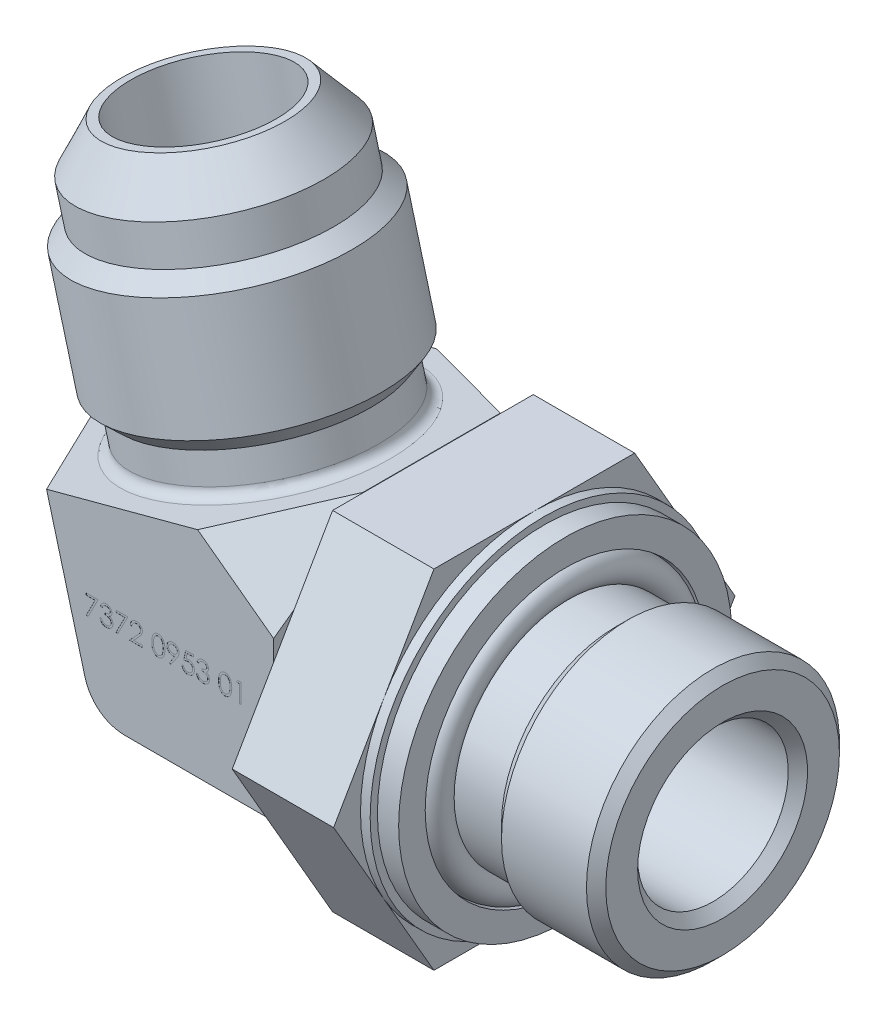
from build123d import *
from OCP.BRepFilletAPI import BRepFilletAPI_MakeChamfer

# Parameters (mm, degrees)
EXTRUDE1_DEPTH      = 15
CHAMFER1_SIZE       = 12
CHAMFER1_SIZE2      = 6.92820323
FILLET1_R           = 11
CHAMFER2_SIZE       = 10
CHAMFER2_SIZE2      = 5.773502692
FILLET4_R           = 5
FILLET3_R           = 1
BOSS_EXTRUDE1_START = 1.5
SKETCH8_R           = 7.8
BOSS_EXTRUDE1_DEPTH = 10.5
SKETCH10_R          = 1.5
CUT_EXTRUDE1_DEPTH  = 0.01


with BuildPart() as part:
    # Sketch1 → Extrude1 (new, symmetric)
    with BuildSketch(Plane.XY):
        Polygon((-0.372025703, 0.275284539), (0.372025703, -0.275284539), (0.372025703, -30.775284539), (-23.627974297, -30.775284539), (-29.832763405, -7.618696336), align=None)
    extrude(amount=EXTRUDE1_DEPTH, both=True)

    # Chamfer1: one chamfer whose edges measure the first distance from different faces: ONE call of the kernel's chamfer builder (chamfer() names one face for all edges)
    chamfer1_edges_1 = [part.edges().sort_by_distance(p)[0] for p in [
        (-11.627974297, -30.775284539, 15),
        (-11.627974297, -30.775284539, -15),
    ]]
    chamfer1_side_1 = [part.faces().sort_by_distance(p)[0] for p in [
        (-11.627974297, -30.775284539, 0),
    ]]
    chamfer1_edges_2 = [part.edges().sort_by_distance(p)[0] for p in [
        (-26.730368851, -19.196990438, -15),
        (-26.730368851, -19.196990438, 15),
    ]]
    chamfer1_side_2 = [part.faces().sort_by_distance(p)[0] for p in [
        (-26.730368851, -19.196990438, 0),
    ]]
    chamfer1 = BRepFilletAPI_MakeChamfer(part.part.solid().wrapped)
    for e in chamfer1_edges_1:
        chamfer1.Add(CHAMFER1_SIZE, CHAMFER1_SIZE2, e.wrapped, chamfer1_side_1[0].wrapped)  # the first distance lies on this face
    for e in chamfer1_edges_2:
        chamfer1.Add(CHAMFER1_SIZE, CHAMFER1_SIZE2, e.wrapped, chamfer1_side_2[0].wrapped)  # the first distance lies on this face
    add(Compound.cast(chamfer1.Shape()), mode=Mode.REPLACE)

    # Fillet1
    fillet1_edges = [part.edges().sort_by_distance(p)[0] for p in [
        (-23.627974297, -30.775284539, 0),
    ]]
    fillet(fillet1_edges, radius=FILLET1_R)

    # Chamfer2: one chamfer whose edges measure the first distance from different faces: ONE call of the kernel's chamfer builder (chamfer() names one face for all edges)
    chamfer2_edges_1 = [part.edges().sort_by_distance(p)[0] for p in [
        (0, 0, 15),
    ]]
    chamfer2_side_1 = [part.faces().sort_by_distance(p)[0] for p in [
        (0, 0, 0),
    ]]
    chamfer2_edges_2 = [part.edges().sort_by_distance(p)[0] for p in [
        (0, 0, -15),
    ]]
    chamfer2_side_2 = [part.faces().sort_by_distance(p)[0] for p in [
        (-9.779622009, -12.745049455, -15),
    ]]
    chamfer2 = BRepFilletAPI_MakeChamfer(part.part.solid().wrapped)
    for e in chamfer2_edges_1:
        chamfer2.Add(CHAMFER2_SIZE, CHAMFER2_SIZE2, e.wrapped, chamfer2_side_1[0].wrapped)  # the first distance lies on this face
    for e in chamfer2_edges_2:
        chamfer2.Add(CHAMFER2_SIZE, CHAMFER2_SIZE2, e.wrapped, chamfer2_side_2[0].wrapped)  # the first distance lies on this face
    add(Compound.cast(chamfer2.Shape()), mode=Mode.REPLACE)

    # Fillet4
    fillet4_edges = [part.edges().sort_by_distance(p)[0] for p in [
        (-20.097765064, -26.174626296, 10.968573826),
        (-20.097765064, -26.174626296, -10.968573826),
    ]]
    fillet(fillet4_edges, radius=FILLET4_R)

    # Sketch4 → Revolve1 (revolve)
    with BuildSketch(Plane.XY, mode=Mode.PRIVATE) as revolve1_sk:
        Polygon((-29.343104541, -1.741709838), (-32.371287369, 9.55962233), (-31.275271858, 11.457976881), (-32.281084351, 15.211720207), (-30.351454157, 19.987722531), (-29.433824622, 20.233600623), (-22.497474213, -5.653211521), (-26.40947381, -6.701428654), (-27.44474999, -2.837725349), align=None)
    revolve(revolve1_sk.sketch.rotate(Axis((-14.963252768, -3.634422969, 0), (-0.25881904510251813, 0.965925826289069, 0)), 180), axis=Axis((-14.963252768, -3.634422969, 0), (-0.25881904510251813, 0.965925826289069, 0)))

    # Sketch5 → Revolve2 (revolve)
    with BuildSketch(Plane.XY, mode=Mode.PRIVATE) as revolve2_sk:
        Polygon((0.372025703, -2.425284539), (14.072025703, -2.425284539), (15.372025703, -3.725284539), (20.772025703, -3.725284539), (22.072025703, -2.425284539), (30.872025703, -2.425284539), (31.872025703, -3.425284539), (31.872025703, -6.725284539), (30.872025703, -7.725284539), (0.372025703, -7.725284539), align=None)
    revolve(revolve2_sk.sketch.rotate(Axis((0.372025703, -15.525284539, 0), (1, 0, 0)), 90), axis=Axis((0.372025703, -15.525284539, 0), (1, 0, 0)))

    # Fillet3
    fillet3_edges = [part.edges().sort_by_distance(p)[0] for p in [
        (-26.40947381, -6.701428654, 0),
        (0.372025703, -15.525284539, -13.1),
    ]]
    fillet(fillet3_edges, radius=FILLET3_R)

    # Sketch6 → Cut-Revolve1 (revolve, cut)
    with BuildSketch(Plane.XY, mode=Mode.PRIVATE) as cut_revolve1_sk:
        Polygon((31.872025703, -7.725284539), (-13.441261468, -7.725284539), (-18.127974297, -15.525284539), (31.872025703, -15.525284539), align=None)
    revolve(cut_revolve1_sk.sketch.rotate(Axis((31.872025703, -15.525284539, 0), (-1, 0, 0)), 270), axis=Axis((31.872025703, -15.525284539, 0), (-1, 0, 0)), mode=Mode.SUBTRACT)

    # Sketch7 → Cut-Revolve2 (revolve, cut)
    with BuildSketch(Plane.XY, mode=Mode.PRIVATE) as cut_revolve2_sk:
        Polygon((-29.433824622, 20.233600623), (-19.776435267, -15.808267119), (-11.029203283, -18.316495529), (-21.899603177, 22.252389175), align=None)
    revolve(cut_revolve2_sk.sketch.rotate(Axis((-20.77322406, 18.048685082, 0), (0.2588190451025186, -0.965925826289069, 0)), 180), axis=Axis((-20.77322406, 18.048685082, 0), (0.2588190451025186, -0.965925826289069, 0)), mode=Mode.SUBTRACT)

    # Sketch8 → Boss-Extrude1 (add)
    with BuildSketch(Plane(origin=(0.372025703, 0, 0), x_dir=(0, 0, -1), z_dir=(1, 0, 0)).offset(BOSS_EXTRUDE1_START)):
        Polygon((20.784609691, -15.525284539), (10.392304845, 2.474715461), (-10.392304845, 2.474715461), (-20.784609691, -15.525284539), (-10.392304845, -33.525284539), (10.392304845, -33.525284539), align=None)
        with Locations(Location((0, -15.525284539, 0), (0, 0, 180))):
            Circle(SKETCH8_R, mode=Mode.SUBTRACT)
    extrude(amount=BOSS_EXTRUDE1_DEPTH)

    # Sketch9 → Revolve3 (revolve)
    with BuildSketch(Plane.XY, mode=Mode.PRIVATE) as revolve3_sk:
        Polygon((12.372025703, -1.025284539), (12.372025703, 2.474715461), (13.372025703, 2.474715461), (13.372025703, 1.724715461), (15.572025703, 1.724715461), (15.572025703, -1.025284539), align=None)
    revolve(revolve3_sk.sketch.rotate(Axis((0.372025703, -15.525284539, 0), (1, 0, 0)), 90), axis=Axis((0.372025703, -15.525284539, 0), (1, 0, 0)))

    # Sketch11 → Cut-Extrude1 (cut)
    # profile 1 of 10: a face of its own
    with BuildSketch(Plane.XY.offset(15)):
        Polygon((-19.038047402, -13.07443493), (-17.807278171, -13.07443493), (-18.858560222, -15.125716981), (-19.013608299, -15.040380443), (-18.110964068, -13.279563135), (-19.038047402, -13.279563135), align=None)
    # profile 2 of 10: a face of its own
    with BuildSketch(Plane.XY.offset(15)):
        with BuildLine():
            Line((-17.371380735, -13.535973391), (-17.550867915, -13.535973391))
            add(Edge.make_bspline(
                [(-17.550867915, -13.535973391), (-17.546005314, -13.515840543), (-17.536499328, -13.476482472), (-17.516672143, -13.420249752), (-17.495072569, -13.367036311), (-17.469135938, -13.317838554), (-17.440845221, -13.271667753), (-17.408432237, -13.22957111), (-17.373392396, -13.190477987), (-17.334635282, -13.155784709), (-17.293990332, -13.124368863), (-17.250884835, -13.097583116), (-17.206186039, -13.074540743), (-17.159584249, -13.055557754), (-17.110940722, -13.041257454), (-17.060695223, -13.030882137), (-17.00871608, -13.024144357), (-16.973431743, -13.023486778), (-16.95551535, -13.023152878)],
                knots=[0, 0, 0, 0, 1.162005537, 2.271625781, 3.343758855, 4.383309926, 5.390229558, 6.379919256, 7.361854164, 8.333198761, 9.295911338, 10.242430842, 11.177959212, 12.116337295, 13.062827104, 14.020064771, 14.994644689, 16, 16, 16, 16], degree=3))
            add(Edge.make_bspline(
                [(-16.95551535, -13.023152878), (-16.929410926, -13.02394101), (-16.877771492, -13.025500082), (-16.801906893, -13.039736903), (-16.728748711, -13.06226555), (-16.659097712, -13.093393394), (-16.594401465, -13.131786144), (-16.53683793, -13.177480279), (-16.487187352, -13.229594166), (-16.445533422, -13.287155631), (-16.412919137, -13.348673065), (-16.388869781, -13.411987441), (-16.37422882, -13.476948567), (-16.372331359, -13.52080987), (-16.371380735, -13.542784289)],
                knots=[0, 0, 0, 0, 1.083050992, 2.142477498, 3.193116406, 4.255571735, 5.30263384, 6.308962982, 7.297363603, 8.282367274, 9.249857812, 10.179914175, 11.08814088, 12, 12, 12, 12], degree=3))
            add(Edge.make_bspline(
                [(-16.371380735, -13.542784289), (-16.372045644, -13.563931029), (-16.373346768, -13.605311917), (-16.3843946, -13.665724201), (-16.40298675, -13.722662258), (-16.4287409, -13.776365779), (-16.462078929, -13.826494259), (-16.502463327, -13.873160483), (-16.550179134, -13.91657143), (-16.586338527, -13.9414397), (-16.604954453, -13.954242622)],
                knots=[0, 0, 0, 0, 1.024540389, 2.004866551, 2.965041327, 3.920577974, 4.882998113, 5.874504559, 6.905732034, 8, 8, 8, 8], degree=3))
            add(Edge.make_bspline(
                [(-16.604954453, -13.954242622), (-16.583679165, -13.964515863), (-16.541526665, -13.984870124), (-16.48406922, -14.0247877), (-16.431910434, -14.070877041), (-16.402822594, -14.106844272), (-16.388207658, -14.124915699)],
                knots=[0, 0, 0, 0, 1.015518401, 2.012035669, 3.001164323, 4, 4, 4, 4], degree=3))
            add(Edge.make_bspline(
                [(-16.388207658, -14.124915699), (-16.378584034, -14.138091557), (-16.359494379, -14.164227509), (-16.335931217, -14.206248324), (-16.31455458, -14.248734889), (-16.297897312, -14.292825979), (-16.284997959, -14.338010558), (-16.27577737, -14.384366213), (-16.270049289, -14.431930797), (-16.269228974, -14.464109357), (-16.268816632, -14.480284289)],
                knots=[0, 0, 0, 0, 1.025084078, 2.033381695, 3.024893161, 4.013698104, 4.991890475, 5.976764909, 6.982997093, 8, 8, 8, 8], degree=3))
            add(Edge.make_bspline(
                [(-16.268816632, -14.480284289), (-16.269842069, -14.508289844), (-16.271888116, -14.564169159), (-16.290176158, -14.646726143), (-16.318526581, -14.72742643), (-16.358787688, -14.804612052), (-16.407854836, -14.876829413), (-16.466230449, -14.941444447), (-16.533251254, -14.996986506), (-16.607997339, -15.043392351), (-16.688978555, -15.080488306), (-16.775593179, -15.106235416), (-16.86659321, -15.123004559), (-16.92899738, -15.12480277), (-16.960723684, -15.125716981)],
                knots=[0, 0, 0, 0, 0.955779014, 1.907060117, 2.875433937, 3.871313158, 4.872415639, 5.851225146, 6.836215519, 7.83643374, 8.849228613, 9.86973379, 10.916971861, 12, 12, 12, 12], degree=3))
            add(Edge.make_bspline(
                [(-16.960723684, -15.125716981), (-16.982106141, -15.125220859), (-17.024179687, -15.124244657), (-17.086033114, -15.11757117), (-17.145074086, -15.105382596), (-17.201382427, -15.088980707), (-17.255008162, -15.068185426), (-17.305787651, -15.042289027), (-17.354033304, -15.011825312), (-17.399289848, -14.97643469), (-17.441551887, -14.936845353), (-17.4796963, -14.89235449), (-17.514359039, -14.843784545), (-17.544611976, -14.79057137), (-17.571833091, -14.733402652), (-17.594222209, -14.671546367), (-17.613928249, -14.605555497), (-17.623090228, -14.559568217), (-17.627790991, -14.535973391)],
                knots=[0, 0, 0, 0, 1.048658725, 2.063410685, 3.046034179, 4.001477787, 4.936774919, 5.862367409, 6.792675028, 7.730719943, 8.675894397, 9.627829632, 10.600096036, 11.597688215, 12.626045268, 13.701542398, 14.82072376, 16, 16, 16, 16], degree=3))
            Line((-17.627790991, -14.535973391), (-17.448303812, -14.535973391))
            add(Edge.make_bspline(
                [(-17.448303812, -14.535973391), (-17.443627645, -14.551372827), (-17.434532095, -14.581326068), (-17.419049639, -14.624434814), (-17.401410627, -14.663953702), (-17.382488022, -14.700172629), (-17.362614624, -14.733448287), (-17.340377524, -14.762900784), (-17.317423727, -14.789823757), (-17.300121239, -14.804992106), (-17.291653171, -14.812415699)],
                knots=[0, 0, 0, 0, 1.198163088, 2.33053128, 3.407730985, 4.417276592, 5.372219308, 6.28897303, 7.162600585, 8, 8, 8, 8], degree=3))
            add(Edge.make_bspline(
                [(-17.291653171, -14.812415699), (-17.280455127, -14.821049033), (-17.258093606, -14.838289051), (-17.221654616, -14.860289981), (-17.183331824, -14.879353424), (-17.142294868, -14.893915536), (-17.099429284, -14.906245628), (-17.054042219, -14.914314496), (-17.006534095, -14.919850594), (-16.974095373, -14.920339126), (-16.957518556, -14.920588776)],
                knots=[0, 0, 0, 0, 0.946170439, 1.889420265, 2.845303464, 3.807233317, 4.801018734, 5.828864929, 6.890507805, 8, 8, 8, 8], degree=3))
            add(Edge.make_bspline(
                [(-16.957518556, -14.920588776), (-16.938802268, -14.92023683), (-16.902204184, -14.91954863), (-16.848801408, -14.913219655), (-16.797997152, -14.904002276), (-16.75035548, -14.889766286), (-16.705252333, -14.872177228), (-16.663319962, -14.850092425), (-16.624007901, -14.824181155), (-16.587819669, -14.794730207), (-16.555279379, -14.762489353), (-16.526628229, -14.728767598), (-16.50227128, -14.693707124), (-16.482623521, -14.657113912), (-16.46710892, -14.619139496), (-16.456547091, -14.579677307), (-16.449203369, -14.539050298), (-16.448605304, -14.511433744), (-16.448303812, -14.497511853)],
                knots=[0, 0, 0, 0, 1.217147791, 2.380027433, 3.494444702, 4.572153297, 5.609568379, 6.639424714, 7.649109417, 8.668170816, 9.669597737, 10.625200337, 11.543417969, 12.441394052, 13.322311151, 14.205496177, 15.095365482, 16, 16, 16, 16], degree=3))
            add(Edge.make_bspline(
                [(-16.448303812, -14.497511853), (-16.44917827, -14.478876802), (-16.450922835, -14.441699426), (-16.464242023, -14.387003669), (-16.486149945, -14.334304576), (-16.516819952, -14.284501268), (-16.554154654, -14.23834361), (-16.597791744, -14.197159905), (-16.648093588, -14.163176996), (-16.694390656, -14.139697764), (-16.735399317, -14.123676578), (-16.770493823, -14.11300517), (-16.80978331, -14.103968795), (-16.852792653, -14.095561783), (-16.899845919, -14.088406727), (-16.950891884, -14.082439975), (-17.00594089, -14.077665666), (-17.044050128, -14.075533611), (-17.063688427, -14.07443493)],
                knots=[0, 0, 0, 0, 1.07054697, 2.135767047, 3.216561865, 4.33974944, 5.486079747, 6.621378074, 7.775625952, 8.963672916, 9.598146892, 10.304877434, 11.070270905, 11.915000392, 12.823868403, 13.805723172, 14.86925407, 16, 16, 16, 16], degree=3))
            Line((-17.063688427, -14.07443493), (-17.063688427, -13.869306725))
            add(Edge.make_bspline(
                [(-17.063688427, -13.869306725), (-17.038944904, -13.868886837), (-16.99047842, -13.86806438), (-16.919681675, -13.858116945), (-16.851982639, -13.844356586), (-16.788881644, -13.823279333), (-16.731368093, -13.798799164), (-16.681471178, -13.770312187), (-16.639889951, -13.738646616), (-16.606826481, -13.703313696), (-16.581952636, -13.665419384), (-16.563765895, -13.625924151), (-16.553022852, -13.58448183), (-16.551588756, -13.556199163), (-16.550867915, -13.541983007)],
                knots=[0, 0, 0, 0, 1.321986639, 2.589447074, 3.816329219, 5.01088745, 6.139805852, 7.153945165, 8.075214402, 8.924034688, 9.728124013, 10.488707548, 11.240355623, 12, 12, 12, 12], degree=3))
            add(Edge.make_bspline(
                [(-16.550867915, -13.541983007), (-16.551104721, -13.531538581), (-16.551575836, -13.510759891), (-16.557517137, -13.480402709), (-16.566445161, -13.450973597), (-16.578719292, -13.422597705), (-16.595147977, -13.395471835), (-16.61480854, -13.369364721), (-16.638218883, -13.344425419), (-16.665044853, -13.321179522), (-16.693851599, -13.299025672), (-16.725422899, -13.280217879), (-16.758806827, -13.264134987), (-16.794040344, -13.250872414), (-16.83123779, -13.240895678), (-16.870224395, -13.23373234), (-16.911074499, -13.22925368), (-16.938944061, -13.228608871), (-16.953111504, -13.228281084)],
                knots=[0, 0, 0, 0, 0.884392785, 1.759457502, 2.611959086, 3.489218968, 4.37281399, 5.2945488, 6.255912374, 7.266815255, 8.301784654, 9.332968512, 10.37626691, 11.440494194, 12.520033166, 13.637162961, 14.798855837, 16, 16, 16, 16], degree=3))
            add(Edge.make_bspline(
                [(-16.953111504, -13.228281084), (-16.975883886, -13.229076148), (-17.020363644, -13.230629092), (-17.084486454, -13.244230814), (-17.144097502, -13.265932576), (-17.189662454, -13.291837159), (-17.223309639, -13.317408835), (-17.247353604, -13.339741628), (-17.270965324, -13.364560384), (-17.292591425, -13.393393741), (-17.314462269, -13.42428905), (-17.334373447, -13.458816868), (-17.353721843, -13.496076522), (-17.365380442, -13.522416885), (-17.371380735, -13.535973391)],
                knots=[0, 0, 0, 0, 1.472543308, 2.876219568, 4.221790263, 5.565193594, 6.249813518, 6.953379497, 7.687249741, 8.463570142, 9.283606569, 10.136032583, 11.040678096, 12, 12, 12, 12], degree=3))
        make_face()
    # profile 3 of 10: a face of its own
    with BuildSketch(Plane.XY.offset(15)):
        Polygon((-15.961124325, -13.07443493), (-14.730355094, -13.07443493), (-15.781637145, -15.125716981), (-15.936685222, -15.040380443), (-15.034040991, -13.279563135), (-15.961124325, -13.279563135), align=None)
    # profile 4 of 10: a face of its own
    with BuildSketch(Plane.XY.offset(15)):
        with BuildLine():
            Line((-14.294457658, -13.689819545), (-14.473944838, -13.689819545))
            add(Edge.make_bspline(
                [(-14.473944838, -13.689819545), (-14.472775036, -13.666007609), (-14.470477576, -13.619241601), (-14.459718554, -13.551056512), (-14.444323767, -13.485882341), (-14.422557222, -13.42424239), (-14.395525063, -13.365591643), (-14.363107905, -13.310163063), (-14.324711419, -13.258168098), (-14.281164713, -13.210088759), (-14.233868348, -13.165981575), (-14.182836383, -13.127892865), (-14.129210653, -13.095711339), (-14.073153854, -13.068807772), (-14.014033532, -13.048613574), (-13.952386184, -13.03362978), (-13.887940963, -13.024614725), (-13.844032379, -13.023645705), (-13.821701248, -13.023152878)],
                knots=[0, 0, 0, 0, 1.10065271, 2.161652631, 3.183658789, 4.190468796, 5.17591951, 6.163126047, 7.15150782, 8.156236427, 9.156009102, 10.134482811, 11.092018607, 12.041330605, 13.001268258, 13.972401359, 14.968799086, 16, 16, 16, 16], degree=3))
            add(Edge.make_bspline(
                [(-13.821701248, -13.023152878), (-13.79977092, -13.023666282), (-13.756678609, -13.024675102), (-13.693786029, -13.033338547), (-13.633913289, -13.046907457), (-13.577177423, -13.065944838), (-13.5240311, -13.091535939), (-13.474075075, -13.12227739), (-13.426714611, -13.157831579), (-13.384082163, -13.199690901), (-13.34493469, -13.244377978), (-13.311161972, -13.292085351), (-13.282240165, -13.341359229), (-13.258132919, -13.392575344), (-13.240386554, -13.446215932), (-13.226913292, -13.501500048), (-13.219297627, -13.55899994), (-13.218128814, -13.597917971), (-13.217534581, -13.61770416)],
                knots=[0, 0, 0, 0, 1.111607364, 2.184268762, 3.212621178, 4.221274766, 5.211760367, 6.196651075, 7.1921475, 8.207485113, 9.220403448, 10.201281604, 11.166441695, 12.114753415, 13.065576456, 14.026450734, 14.996634279, 16, 16, 16, 16], degree=3))
            add(Edge.make_bspline(
                [(-13.217534581, -13.61770416), (-13.21850216, -13.645560066), (-13.220420338, -13.700783045), (-13.236828553, -13.781934395), (-13.262455131, -13.860559206), (-13.293310763, -13.923837665), (-13.324437874, -13.974828232), (-13.352487879, -14.01681035), (-13.385324913, -14.062013474), (-13.423426912, -14.110286239), (-13.466005696, -14.162006756), (-13.513446933, -14.217143782), (-13.566088922, -14.27512765), (-13.603036637, -14.314730851), (-13.622182017, -14.335252237)],
                knots=[0, 0, 0, 0, 1.184426356, 2.348067706, 3.509069118, 4.696110526, 5.333549288, 6.050745305, 6.844228056, 7.710549037, 8.667450064, 9.695053472, 10.805634456, 12, 12, 12, 12], degree=3))
            Line((-13.622182017, -14.335252237), (-14.122582658, -14.869306725))
            Line((-14.122582658, -14.869306725), (-13.191893556, -14.869306725))
            Line((-13.191893556, -14.869306725), (-13.191893556, -15.07443493))
            Line((-13.191893556, -15.07443493), (-14.550867915, -15.07443493))
            Line((-14.550867915, -15.07443493), (-13.775226889, -14.246710571))
            add(Edge.make_bspline(
                [(-13.775226889, -14.246710571), (-13.756342382, -14.226997253), (-13.720069109, -14.189132003), (-13.66876478, -14.133850312), (-13.622685358, -14.08256486), (-13.581532562, -14.035372546), (-13.54619913, -13.991583079), (-13.514843569, -13.952614677), (-13.489720375, -13.916754991), (-13.462454434, -13.875188926), (-13.436046445, -13.824439031), (-13.41335367, -13.76241978), (-13.399516614, -13.698575635), (-13.397856708, -13.655431614), (-13.397021761, -13.633729801)],
                knots=[0, 0, 0, 0, 1.329631726, 2.553950428, 3.673215718, 4.687767853, 5.603093632, 6.413772471, 7.123043292, 7.734684054, 8.834405432, 9.900288307, 10.943827018, 12, 12, 12, 12], degree=3))
            add(Edge.make_bspline(
                [(-13.397021761, -13.633729801), (-13.397385042, -13.620083288), (-13.398101, -13.593188631), (-13.404419684, -13.553756768), (-13.413968545, -13.515719732), (-13.427651549, -13.478960521), (-13.445712544, -13.44384872), (-13.467697332, -13.410341588), (-13.493063083, -13.377947894), (-13.522406665, -13.347574581), (-13.554641819, -13.319756749), (-13.588695676, -13.295114415), (-13.624724307, -13.274520637), (-13.662575806, -13.257638639), (-13.702144645, -13.244395564), (-13.743507357, -13.235219232), (-13.786549652, -13.229457813), (-13.815940221, -13.228678286), (-13.830915991, -13.228281084)],
                knots=[0, 0, 0, 0, 0.991446411, 1.95395049, 2.89581595, 3.838931463, 4.798493298, 5.75982156, 6.748411868, 7.785213223, 8.824556874, 9.840280684, 10.836137867, 11.835679398, 12.848801643, 13.863922112, 14.911575587, 16, 16, 16, 16], degree=3))
            add(Edge.make_bspline(
                [(-13.830915991, -13.228281084), (-13.846556467, -13.228689673), (-13.877271779, -13.229492076), (-13.92236837, -13.235105027), (-13.965388814, -13.244788365), (-14.00644133, -13.258032179), (-14.045595379, -13.274865635), (-14.082660547, -13.295832346), (-14.117553627, -13.320851485), (-14.150340211, -13.349217517), (-14.180548199, -13.380799004), (-14.207089271, -13.416004697), (-14.230280137, -13.454191792), (-14.250513984, -13.495257249), (-14.266945807, -13.539573695), (-14.279501893, -13.586983812), (-14.289437234, -13.637281744), (-14.292756389, -13.672016078), (-14.294457658, -13.689819545)],
                knots=[0, 0, 0, 0, 1.031018746, 2.02475058, 2.990194455, 3.934040569, 4.864654155, 5.795059489, 6.735614925, 7.690564532, 8.649604399, 9.611025574, 10.590972636, 11.591080095, 12.624614302, 13.701020113, 14.821632451, 16, 16, 16, 16], degree=3))
        make_face()
    # profile 5 of 10: a face of its own
    with BuildSketch(Plane.XY.offset(15)):
        with BuildLine():
            add(Edge.make_bspline(
                [(-12.243175607, -14.075236212), (-12.242988168, -14.043180562), (-12.242624065, -13.980911999), (-12.238573539, -13.890177918), (-12.231844772, -13.805057753), (-12.222623416, -13.725547429), (-12.211401713, -13.651626421), (-12.196421435, -13.583492274), (-12.179385548, -13.520829642), (-12.159641293, -13.463434186), (-12.137362556, -13.410532641), (-12.113114407, -13.361146812), (-12.085934525, -13.315351422), (-12.057376289, -13.272415542), (-12.026283676, -13.233042002), (-11.99354151, -13.196674766), (-11.957871867, -13.164154337), (-11.920487291, -13.134527879), (-11.881049311, -13.108556752), (-11.840682073, -13.085680901), (-11.799107727, -13.06613812), (-11.756212765, -13.050772157), (-11.712382732, -13.038080244), (-11.667464408, -13.029400846), (-11.621383629, -13.023939755), (-11.590279952, -13.023417659), (-11.574505735, -13.023152878)],
                knots=[0, 0, 0, 0, 1.646270934, 3.197905019, 4.663502075, 6.030701355, 7.308322542, 8.50163776, 9.611534131, 10.641858119, 11.616356847, 12.558055219, 13.465016945, 14.349605745, 15.204443733, 16.039544428, 16.859896111, 17.680448484, 18.487036065, 19.28249412, 20.06191084, 20.843045899, 21.620316918, 22.403196591, 23.190181807, 24, 24, 24, 24], degree=3))
            add(Edge.make_bspline(
                [(-11.574505735, -13.023152878), (-11.558599747, -13.02343163), (-11.526967742, -13.023985979), (-11.480201814, -13.029313946), (-11.434516281, -13.038154588), (-11.390105916, -13.050680859), (-11.346605924, -13.066221246), (-11.304356548, -13.085699598), (-11.263095359, -13.108373237), (-11.223478051, -13.135015453), (-11.1850697, -13.16471961), (-11.148813721, -13.198298278), (-11.114706815, -13.235412404), (-11.082320926, -13.275664897), (-11.05257487, -13.319827803), (-11.024247195, -13.367133008), (-10.998891746, -13.418407788), (-10.974471931, -13.472796627), (-10.953393653, -13.531804432), (-10.93438437, -13.595098581), (-10.91902496, -13.663426688), (-10.90623109, -13.736430256), (-10.896319721, -13.81437739), (-10.889101068, -13.897100999), (-10.885287876, -13.984655508), (-10.884569762, -14.044517136), (-10.884201248, -14.075236212)],
                knots=[0, 0, 0, 0, 0.810914788, 1.612654377, 2.396697861, 3.181598691, 3.963628158, 4.749916497, 5.551656086, 6.361998678, 7.18212741, 8.025565596, 8.878627764, 9.750805457, 10.657531673, 11.591944965, 12.560506719, 13.57287815, 14.630710178, 15.753379473, 16.941251878, 18.199788006, 19.531962791, 20.947069417, 22.433333509, 24, 24, 24, 24], degree=3))
            add(Edge.make_bspline(
                [(-10.884201248, -14.075236212), (-10.884573582, -14.105821302), (-10.88529906, -14.165415103), (-10.889058321, -14.25257566), (-10.896463253, -14.334860257), (-10.905726103, -14.412466235), (-10.918555225, -14.485070589), (-10.934329606, -14.552924559), (-10.951844076, -14.616321172), (-10.973463958, -14.674741064), (-10.997127221, -14.728999191), (-11.022873047, -14.779666133), (-11.050455805, -14.827189729), (-11.080506517, -14.871189584), (-11.112537039, -14.911977389), (-11.147232918, -14.948833173), (-11.183616109, -14.982644985), (-11.22213749, -15.01273163), (-11.262372662, -15.039065804), (-11.303492134, -15.062616575), (-11.346225496, -15.081606687), (-11.389604326, -15.097912425), (-11.434249107, -15.110369826), (-11.480104188, -15.118983457), (-11.526936322, -15.125024514), (-11.55859436, -15.125485359), (-11.574505735, -15.125716981)],
                knots=[0, 0, 0, 0, 1.561518951, 3.042555995, 4.452378317, 5.7783523, 7.031515105, 8.214008947, 9.334062868, 10.386615937, 11.391082383, 12.354592575, 13.286541444, 14.194233754, 15.072674879, 15.931287219, 16.775624067, 17.606195743, 18.42308326, 19.229000347, 20.022332153, 20.807536673, 21.593273796, 22.3848459, 23.188221202, 24, 24, 24, 24], degree=3))
            add(Edge.make_bspline(
                [(-11.574505735, -15.125716981), (-11.590279514, -15.125450492), (-11.621382329, -15.124925028), (-11.667469429, -15.11948861), (-11.712202254, -15.110748323), (-11.755801542, -15.098510263), (-11.798490979, -15.083530357), (-11.839688857, -15.064013966), (-11.879853248, -15.041537355), (-11.918876994, -15.015939972), (-11.9560268, -14.986613295), (-11.991511718, -14.954176559), (-12.0244403, -14.917820324), (-12.055088355, -14.878118654), (-12.084216405, -14.835436801), (-12.111010333, -14.789192016), (-12.135793678, -14.739567668), (-12.158447101, -14.686243147), (-12.178532052, -14.628440331), (-12.196273599, -14.565497943), (-12.210281689, -14.496860437), (-12.222271949, -14.423079085), (-12.231943025, -14.343836839), (-12.238545497, -14.25909068), (-12.242626248, -14.168893417), (-12.242989146, -14.107024975), (-12.243175607, -14.075236212)],
                knots=[0, 0, 0, 0, 0.810891512, 1.598919785, 2.382837074, 3.152667961, 3.926044502, 4.706494248, 5.493654104, 6.291793342, 7.103789334, 7.925228297, 8.761435821, 9.622817696, 10.50288917, 11.416980706, 12.369136599, 13.353924996, 14.394355917, 15.514179734, 16.714354668, 17.994756427, 19.357759367, 20.818452758, 22.365282078, 24, 24, 24, 24], degree=3))
        make_face()
        with BuildLine():
            add(Edge.make_bspline(
                [(-12.063688427, -14.07443493), (-12.063620172, -14.101148472), (-12.063487701, -14.152994212), (-12.060027015, -14.228333218), (-12.055312597, -14.298601977), (-12.049231856, -14.363889712), (-12.0402016, -14.423975434), (-12.030083435, -14.479272396), (-12.017770241, -14.52948796), (-12.003201659, -14.574966709), (-11.98660789, -14.616480462), (-11.968490253, -14.655109728), (-11.949026983, -14.691310834), (-11.927244611, -14.724758611), (-11.903521718, -14.755562133), (-11.878394141, -14.784266609), (-11.850924093, -14.809864884), (-11.812921955, -14.840565944), (-11.762752541, -14.872291163), (-11.699540852, -14.8999175), (-11.634587451, -14.917278904), (-11.590501023, -14.919486764), (-11.56849612, -14.920588776)],
                knots=[0, 0, 0, 0, 1.459021318, 2.831673884, 4.118529203, 5.306027144, 6.411944654, 7.436330062, 8.375795394, 9.233974572, 10.042671642, 10.816086306, 11.563610507, 12.285937304, 12.993564865, 13.685989202, 14.367179055, 15.041617293, 16.353048772, 17.594441528, 18.799311195, 20, 20, 20, 20], degree=3))
            add(Edge.make_bspline(
                [(-11.56849612, -14.920588776), (-11.546348879, -14.919675758), (-11.502100123, -14.917851608), (-11.43745224, -14.90025233), (-11.374692085, -14.873698307), (-11.325508119, -14.842299733), (-11.288089523, -14.81239783), (-11.261279815, -14.786903745), (-11.23667293, -14.758357535), (-11.213334601, -14.727557938), (-11.191929415, -14.693916518), (-11.172464765, -14.657595047), (-11.154702852, -14.618492659), (-11.144583397, -14.591195665), (-11.139409581, -14.577239417)],
                knots=[0, 0, 0, 0, 1.353760809, 2.704726607, 4.075137775, 5.516104923, 6.260822281, 7.007110065, 7.778089737, 8.566572457, 9.372053459, 10.217411131, 11.088608312, 12, 12, 12, 12], degree=3))
            add(Edge.make_bspline(
                [(-11.139409581, -14.577239417), (-11.13338, -14.559393851), (-11.121137363, -14.5231597), (-11.105359206, -14.466951899), (-11.092933264, -14.407978891), (-11.081754198, -14.34659311), (-11.07412388, -14.282341853), (-11.067982273, -14.215423919), (-11.064364737, -14.145788855), (-11.063916308, -14.098477431), (-11.063688427, -14.07443493)],
                knots=[0, 0, 0, 0, 0.884706709, 1.796334032, 2.740027952, 3.714592787, 4.726048262, 5.777819803, 6.87074269, 8, 8, 8, 8], degree=3))
            add(Edge.make_bspline(
                [(-11.063688427, -14.07443493), (-11.064002821, -14.050396317), (-11.064617843, -14.003371651), (-11.066968693, -13.934504119), (-11.073039307, -13.86909397), (-11.079781661, -13.806859415), (-11.08972293, -13.748144956), (-11.100441676, -13.692459067), (-11.114842369, -13.640491624), (-11.130225098, -13.591429006), (-11.147831038, -13.545828632), (-11.167211458, -13.503477897), (-11.187909606, -13.46417234), (-11.210390886, -13.428019802), (-11.234388419, -13.394858349), (-11.26053559, -13.365352866), (-11.287795232, -13.338588885), (-11.325976481, -13.308038845), (-11.375961789, -13.276889305), (-11.438159302, -13.248223156), (-11.502885384, -13.231761275), (-11.546641644, -13.229440311), (-11.56849612, -13.228281084)],
                knots=[0, 0, 0, 0, 1.31362396, 2.569729283, 3.763502607, 4.902122613, 5.988968491, 7.01645872, 7.998833611, 8.933434873, 9.825090667, 10.667526885, 11.477055099, 12.250526234, 12.991942729, 13.710640831, 14.402115721, 15.076753259, 16.378508321, 17.609869233, 18.806226677, 20, 20, 20, 20], degree=3))
            add(Edge.make_bspline(
                [(-11.56849612, -13.228281084), (-11.590616458, -13.22944191), (-11.634897433, -13.231765678), (-11.700296264, -13.248161823), (-11.762984465, -13.276740661), (-11.812837593, -13.308142017), (-11.851045471, -13.338049623), (-11.877949867, -13.36398474), (-11.903176252, -13.392354028), (-11.926414937, -13.423440836), (-11.948180242, -13.456849618), (-11.968169392, -13.492843198), (-11.986179295, -13.531603977), (-12.00279903, -13.573099083), (-12.017412051, -13.618573908), (-12.029465745, -13.668727619), (-12.040601204, -13.7238487), (-12.048484214, -13.784259847), (-12.055492075, -13.849563935), (-12.059995702, -13.920008117), (-12.063499278, -13.995473477), (-12.063624115, -14.047587282), (-12.063688427, -14.07443493)],
                knots=[0, 0, 0, 0, 1.207732386, 2.417664972, 3.655092373, 4.956220595, 5.625982001, 6.301752483, 6.994047911, 7.697131622, 8.419323945, 9.170223765, 9.943494443, 10.752040957, 11.610060368, 12.549350801, 13.567764191, 14.679664412, 15.874934091, 17.154273443, 18.533957287, 20, 20, 20, 20], degree=3))
        make_face(mode=Mode.SUBTRACT)
    # profile 6 of 10: a face of its own
    with BuildSketch(Plane.XY.offset(15)):
        with BuildLine():
            Line((-10.268816632, -15.125716981), (-10.41224612, -15.025957366))
            Line((-10.41224612, -15.025957366), (-9.856156376, -14.213056725))
            add(Edge.make_bspline(
                [(-9.856156376, -14.213056725), (-9.891636796, -14.217395618), (-9.961499722, -14.225939141), (-10.031863781, -14.227508658), (-10.066492915, -14.228281084)],
                knots=[0, 0, 0, 0, 1.015715272, 2, 2, 2, 2], degree=3))
            add(Edge.make_bspline(
                [(-10.066492915, -14.228281084), (-10.08748837, -14.227743326), (-10.128700614, -14.226687754), (-10.18929013, -14.218321006), (-10.24751045, -14.205435219), (-10.303207225, -14.186207359), (-10.356589799, -14.162311239), (-10.407541636, -14.13267866), (-10.455994144, -14.097817922), (-10.50142695, -14.057913355), (-10.542747944, -14.014097325), (-10.579561257, -13.967722672), (-10.610156189, -13.918250689), (-10.635571381, -13.866690564), (-10.654845926, -13.81230122), (-10.668881662, -13.755701563), (-10.677523007, -13.696494911), (-10.678551062, -13.656194836), (-10.679073043, -13.635733007)],
                knots=[0, 0, 0, 0, 1.060718605, 2.082097864, 3.085795603, 4.069760067, 5.054557537, 6.03741023, 7.043284206, 8.066802108, 9.088538119, 10.083643548, 11.053783639, 12.022749082, 12.983451788, 13.964007469, 14.966251758, 16, 16, 16, 16], degree=3))
            add(Edge.make_bspline(
                [(-10.679073043, -13.635733007), (-10.678081937, -13.607750919), (-10.676136598, -13.552827758), (-10.660480302, -13.47257989), (-10.634731537, -13.396701866), (-10.598829607, -13.325393183), (-10.553609767, -13.259679618), (-10.499262001, -13.200474699), (-10.436116878, -13.148620496), (-10.365612867, -13.104046738), (-10.289411141, -13.068198168), (-10.20960048, -13.041775711), (-10.126792411, -13.026233569), (-10.070696599, -13.024184505), (-10.042454453, -13.023152878)],
                knots=[0, 0, 0, 0, 1.022988612, 2.007919123, 2.978103895, 3.94594894, 4.918897164, 5.887013414, 6.875921846, 7.89917871, 8.930658928, 9.948724884, 10.967259574, 12, 12, 12, 12], degree=3))
            add(Edge.make_bspline(
                [(-10.042454453, -13.023152878), (-10.014746785, -13.024198686), (-9.959999044, -13.026265103), (-9.87949104, -13.041398799), (-9.802381887, -13.06690547), (-9.729099038, -13.102153792), (-9.661247945, -13.146337168), (-9.600233196, -13.198985467), (-9.547447173, -13.260131482), (-9.502976384, -13.328296334), (-9.467279219, -13.401534609), (-9.441523628, -13.477982565), (-9.425668977, -13.557090405), (-9.423671076, -13.610687248), (-9.422662786, -13.637736212)],
                knots=[0, 0, 0, 0, 1.026385292, 2.028040595, 3.023318987, 4.028184125, 5.03290303, 6.015178782, 7.004435299, 8.016004309, 9.023023918, 10.015172535, 10.998308025, 12, 12, 12, 12], degree=3))
            add(Edge.make_bspline(
                [(-9.422662786, -13.637736212), (-9.423336163, -13.65873265), (-9.424701939, -13.701318673), (-9.434265543, -13.766021726), (-9.450505649, -13.831993858), (-9.468935191, -13.887834769), (-9.486725001, -13.933953884), (-9.503468505, -13.970383358), (-9.522046878, -14.008726937), (-9.543714744, -14.048582559), (-9.567007485, -14.090458293), (-9.593327072, -14.13393413), (-9.622073113, -14.179068412), (-9.642547238, -14.20949532), (-9.653031376, -14.225075955)],
                knots=[0, 0, 0, 0, 1.179839688, 2.393009684, 3.667231171, 4.993948276, 5.694988576, 6.444077775, 7.246288328, 8.089075292, 8.993003841, 9.939041771, 10.944649915, 12, 12, 12, 12], degree=3))
            Line((-9.653031376, -14.225075955), (-10.268816632, -15.125716981))
        make_face()
        with BuildLine():
            add(Edge.make_bspline(
                [(-10.033239709, -14.023152878), (-10.017334558, -14.022718373), (-9.986372637, -14.02187254), (-9.94101418, -14.016724402), (-9.89820035, -14.00759641), (-9.857816779, -13.994499431), (-9.819458549, -13.97869562), (-9.783734933, -13.958574486), (-9.750616033, -13.93456498), (-9.719880074, -13.907587828), (-9.69258636, -13.877616066), (-9.668276057, -13.846246291), (-9.647612876, -13.813340799), (-9.631291003, -13.778487507), (-9.617871246, -13.742534816), (-9.60860381, -13.704903756), (-9.603469905, -13.665790384), (-9.60259472, -13.639219722), (-9.602149966, -13.625716981)],
                knots=[0, 0, 0, 0, 1.163407946, 2.26475976, 3.333800367, 4.359385343, 5.366239384, 6.363380779, 7.350133999, 8.353570782, 9.349036268, 10.310270964, 11.253520213, 12.184142, 13.120487599, 14.056272588, 15.012232024, 16, 16, 16, 16], degree=3))
            add(Edge.make_bspline(
                [(-9.602149966, -13.625716981), (-9.602532634, -13.612208601), (-9.603286728, -13.585588681), (-9.609336614, -13.546417401), (-9.619979599, -13.508878395), (-9.634259875, -13.472766149), (-9.65307144, -13.438377365), (-9.67564486, -13.405280296), (-9.702463403, -13.373684794), (-9.733322012, -13.344333946), (-9.7665989, -13.317278004), (-9.802062043, -13.293400246), (-9.839419138, -13.273388134), (-9.878442275, -13.256874437), (-9.91921276, -13.243987708), (-9.961706467, -13.234720642), (-10.006138128, -13.229593925), (-10.036298863, -13.228724271), (-10.051669197, -13.228281084)],
                knots=[0, 0, 0, 0, 0.972161553, 1.915763587, 2.844109794, 3.775983486, 4.705125789, 5.659731448, 6.655561913, 7.682237399, 8.721216875, 9.739758359, 10.754845918, 11.767244016, 12.7857855, 13.828538656, 14.893392813, 16, 16, 16, 16], degree=3))
            add(Edge.make_bspline(
                [(-10.051669197, -13.228281084), (-10.066905856, -13.228724987), (-10.096800055, -13.229595923), (-10.140836718, -13.234710897), (-10.183043099, -13.244050031), (-10.223695454, -13.256868468), (-10.262717431, -13.273389366), (-10.300072764, -13.293401295), (-10.335544202, -13.317272507), (-10.368789186, -13.344355235), (-10.399702284, -13.373548175), (-10.426059729, -13.405418706), (-10.44868481, -13.438360149), (-10.467470526, -13.472770725), (-10.481757679, -13.508877174), (-10.492398823, -13.546417732), (-10.498449203, -13.585588595), (-10.49920323, -13.612208572), (-10.499585863, -13.625716981)],
                knots=[0, 0, 0, 0, 1.099389452, 2.15699305, 3.192601482, 4.213358962, 5.227959689, 6.245255729, 7.266013209, 8.307253147, 9.336162325, 10.327954924, 11.284637477, 12.215801273, 13.149702402, 14.080068371, 15.025723358, 16, 16, 16, 16], degree=3))
            add(Edge.make_bspline(
                [(-10.499585863, -13.625716981), (-10.49923962, -13.639230237), (-10.498556764, -13.665880852), (-10.491969456, -13.705038791), (-10.480953296, -13.742574902), (-10.466199358, -13.778854163), (-10.446769878, -13.813523796), (-10.422927679, -13.846419432), (-10.394981653, -13.877913975), (-10.363305375, -13.907518096), (-10.328637854, -13.934690768), (-10.291611142, -13.958422414), (-10.252862664, -13.978463811), (-10.212256018, -13.994544602), (-10.170092132, -14.007465553), (-10.125992057, -14.016707578), (-10.080101635, -14.021823159), (-10.049010217, -14.022705386), (-10.033239709, -14.023152878)],
                knots=[0, 0, 0, 0, 0.952633368, 1.87876736, 2.791047057, 3.707742249, 4.635551637, 5.587206343, 6.568248508, 7.601284464, 8.641511608, 9.671105535, 10.699146789, 11.713763218, 12.747829548, 13.806491675, 14.887386225, 16, 16, 16, 16], degree=3))
        make_face(mode=Mode.SUBTRACT)
    # profile 7 of 10: a face of its own
    with BuildSketch(Plane.XY.offset(15)):
        with BuildLine():
            Line((-7.909842273, -13.07443493), (-7.909842273, -13.279563135))
            Line((-7.909842273, -13.279563135), (-8.590130735, -13.279563135))
            Line((-8.590130735, -13.279563135), (-8.697903171, -13.805604801))
            add(Edge.make_bspline(
                [(-8.697903171, -13.805604801), (-8.676728386, -13.799758932), (-8.635705588, -13.788433484), (-8.575157096, -13.775858758), (-8.517675837, -13.768278504), (-8.480375625, -13.76724347), (-8.462326248, -13.766742622)],
                knots=[0, 0, 0, 0, 1.100273476, 2.13160584, 3.095893838, 4, 4, 4, 4], degree=3))
            add(Edge.make_bspline(
                [(-8.462326248, -13.766742622), (-8.439992682, -13.767226014), (-8.396079312, -13.768176483), (-8.331828486, -13.777303254), (-8.270495404, -13.79166892), (-8.212208335, -13.811737789), (-8.156859449, -13.837400494), (-8.104957985, -13.869457603), (-8.055724892, -13.90690522), (-8.01004341, -13.949959513), (-7.968600948, -13.997343294), (-7.93216324, -14.048290649), (-7.901213188, -14.102306456), (-7.876321328, -14.159906804), (-7.856444566, -14.220454891), (-7.843214854, -14.284587796), (-7.834405306, -14.351701007), (-7.833421086, -14.397589333), (-7.832919197, -14.420989417)],
                knots=[0, 0, 0, 0, 1.052922333, 2.070308379, 3.05430497, 4.020497103, 4.973039431, 5.925935799, 6.892292201, 7.88610001, 8.88166317, 9.857072816, 10.836096531, 11.812156883, 12.81219415, 13.836441305, 14.89672472, 16, 16, 16, 16], degree=3))
            add(Edge.make_bspline(
                [(-7.832919197, -14.420989417), (-7.83329924, -14.437287829), (-7.83405419, -14.469664393), (-7.837893383, -14.517746793), (-7.84528522, -14.564811269), (-7.855209634, -14.610864065), (-7.868091016, -14.655817992), (-7.883684761, -14.699801722), (-7.902768205, -14.742541497), (-7.92370042, -14.784441723), (-7.947269836, -14.824555156), (-7.973428983, -14.862068862), (-8.001066406, -14.897545594), (-8.030804341, -14.93060487), (-8.062919195, -14.961029452), (-8.097022033, -14.988999899), (-8.13284073, -15.01498923), (-8.17092944, -15.037942485), (-8.21043943, -15.059064174), (-8.251941268, -15.076391909), (-8.29449024, -15.09188364), (-8.338698741, -15.104231941), (-8.384466633, -15.113907687), (-8.431869362, -15.120479458), (-8.480658317, -15.125265994), (-8.513729752, -15.125565627), (-8.530435222, -15.125716981)],
                knots=[0, 0, 0, 0, 1.056347294, 2.098418968, 3.122841568, 4.141288669, 5.149314143, 6.15115421, 7.162517403, 8.180376062, 9.185164535, 10.17417709, 11.141909838, 12.097768115, 13.052685741, 14.0056014, 14.954263652, 15.917497458, 16.885230207, 17.854509472, 18.828990115, 19.81800267, 20.826176721, 21.857883937, 22.917946725, 24, 24, 24, 24], degree=3))
            add(Edge.make_bspline(
                [(-8.530435222, -15.125716981), (-8.550363325, -15.125322216), (-8.589569514, -15.124545564), (-8.647009838, -15.116420715), (-8.702275327, -15.104784191), (-8.7549211, -15.087277751), (-8.805418965, -15.065342155), (-8.853089089, -15.037618628), (-8.899149532, -15.006201997), (-8.941727839, -14.96912751), (-8.981245618, -14.928604263), (-9.016620766, -14.884628468), (-9.048125667, -14.83792593), (-9.075255808, -14.788269842), (-9.098397535, -14.735790681), (-9.116577528, -14.680291823), (-9.131250874, -14.62206325), (-9.137458543, -14.58197553), (-9.140611504, -14.561614417)],
                knots=[0, 0, 0, 0, 1.0467383, 2.05933395, 3.04377827, 4.011590433, 4.970194871, 5.932262533, 6.905835911, 7.896367577, 8.894135286, 9.877477877, 10.858688626, 11.851381753, 12.8477658, 13.868841284, 14.917554742, 16, 16, 16, 16], degree=3))
            Line((-9.140611504, -14.561614417), (-8.961124325, -14.561614417))
            add(Edge.make_bspline(
                [(-8.961124325, -14.561614417), (-8.956708006, -14.580686675), (-8.948219597, -14.617344615), (-8.92958774, -14.668848239), (-8.90680724, -14.714744938), (-8.879719041, -14.755641843), (-8.847404738, -14.791304127), (-8.810530779, -14.823085305), (-8.769189222, -14.851756808), (-8.723250234, -14.875655532), (-8.674785617, -14.896037677), (-8.624061497, -14.909610074), (-8.572459014, -14.919153441), (-8.537557088, -14.920108733), (-8.520018556, -14.920588776)],
                knots=[0, 0, 0, 0, 1.136247022, 2.183929868, 3.172523383, 4.106158343, 5.02341133, 5.958108904, 6.928429099, 7.938127109, 8.96079061, 9.975095812, 10.982467395, 12, 12, 12, 12], degree=3))
            add(Edge.make_bspline(
                [(-8.520018556, -14.920588776), (-8.502899444, -14.92011976), (-8.469191775, -14.919196264), (-8.419585268, -14.912088257), (-8.371692197, -14.901141073), (-8.325985136, -14.884758299), (-8.281664256, -14.864847031), (-8.239850673, -14.839295559), (-8.199334743, -14.809889834), (-8.16137581, -14.776200332), (-8.12661041, -14.739074792), (-8.095892627, -14.699373424), (-8.070305819, -14.65702094), (-8.048743471, -14.612750567), (-8.032370158, -14.566077106), (-8.020689597, -14.517219292), (-8.013830706, -14.466056446), (-8.012887175, -14.431159697), (-8.012406376, -14.413377237)],
                knots=[0, 0, 0, 0, 1.027316725, 2.022795036, 3.002884548, 3.971462791, 4.93288096, 5.914575861, 6.907176829, 7.935150275, 8.956128384, 9.956726525, 10.942570165, 11.921478529, 12.907843606, 13.90538589, 14.932640048, 16, 16, 16, 16], degree=3))
            add(Edge.make_bspline(
                [(-8.012406376, -14.413377237), (-8.01278265, -14.397333951), (-8.013519153, -14.3659315), (-8.019536622, -14.319989096), (-8.030003463, -14.276518786), (-8.044531394, -14.235310653), (-8.062976827, -14.196325828), (-8.085517577, -14.15952408), (-8.112576662, -14.125390461), (-8.143486312, -14.093909002), (-8.17734805, -14.064854787), (-8.214744474, -14.040086738), (-8.254893004, -14.019250214), (-8.297309918, -14.0012685), (-8.343004146, -13.988353789), (-8.391070793, -13.978657854), (-8.442028912, -13.973049075), (-8.476869305, -13.972270853), (-8.494778171, -13.971870827)],
                knots=[0, 0, 0, 0, 1.045622112, 2.046656509, 3.013763289, 3.955457236, 4.890082067, 5.820317437, 6.762574623, 7.722996705, 8.69280354, 9.665887285, 10.63943826, 11.638615906, 12.663482002, 13.728887084, 14.832589034, 16, 16, 16, 16], degree=3))
            add(Edge.make_bspline(
                [(-8.494778171, -13.971870827), (-8.510280416, -13.972202594), (-8.542288619, -13.972887607), (-8.591387377, -13.977931319), (-8.642982647, -13.986068059), (-8.696876645, -13.9972602), (-8.753231221, -14.01190653), (-8.81192745, -14.029457673), (-8.873088745, -14.050441673), (-8.914298873, -14.066288652), (-8.935483299, -14.07443493)],
                knots=[0, 0, 0, 0, 0.817624296, 1.688186739, 2.600797293, 3.572016777, 4.590301741, 5.671205678, 6.80286297, 8, 8, 8, 8], degree=3))
            Line((-8.935483299, -14.07443493), (-8.730355094, -13.07443493))
            Line((-8.730355094, -13.07443493), (-7.909842273, -13.07443493))
        make_face()
    # profile 8 of 10: a face of its own
    with BuildSketch(Plane.XY.offset(15)):
        with BuildLine():
            Line((-7.371380735, -13.535973391), (-7.550867915, -13.535973391))
            add(Edge.make_bspline(
                [(-7.550867915, -13.535973391), (-7.546005314, -13.515840543), (-7.536499328, -13.476482472), (-7.516672143, -13.420249752), (-7.495072569, -13.367036311), (-7.469135938, -13.317838554), (-7.440845221, -13.271667753), (-7.408432237, -13.22957111), (-7.373392396, -13.190477987), (-7.334635282, -13.155784709), (-7.293990332, -13.124368863), (-7.250884835, -13.097583116), (-7.206186039, -13.074540743), (-7.159584249, -13.055557754), (-7.110940722, -13.041257454), (-7.060695223, -13.030882137), (-7.00871608, -13.024144357), (-6.973431743, -13.023486778), (-6.95551535, -13.023152878)],
                knots=[0, 0, 0, 0, 1.162005537, 2.271625781, 3.343758855, 4.383309926, 5.390229558, 6.379919256, 7.361854164, 8.333198761, 9.295911338, 10.242430842, 11.177959212, 12.116337295, 13.062827104, 14.020064771, 14.994644689, 16, 16, 16, 16], degree=3))
            add(Edge.make_bspline(
                [(-6.95551535, -13.023152878), (-6.929410926, -13.02394101), (-6.877771492, -13.025500082), (-6.801906893, -13.039736903), (-6.728748711, -13.06226555), (-6.659097712, -13.093393394), (-6.594401465, -13.131786144), (-6.53683793, -13.177480279), (-6.487187352, -13.229594166), (-6.445533422, -13.287155631), (-6.412919137, -13.348673065), (-6.388869781, -13.411987441), (-6.37422882, -13.476948567), (-6.372331359, -13.52080987), (-6.371380735, -13.542784289)],
                knots=[0, 0, 0, 0, 1.083050992, 2.142477498, 3.193116406, 4.255571735, 5.30263384, 6.308962982, 7.297363603, 8.282367274, 9.249857812, 10.179914175, 11.08814088, 12, 12, 12, 12], degree=3))
            add(Edge.make_bspline(
                [(-6.371380735, -13.542784289), (-6.372045644, -13.563931029), (-6.373346768, -13.605311917), (-6.3843946, -13.665724201), (-6.40298675, -13.722662258), (-6.4287409, -13.776365779), (-6.462078929, -13.826494259), (-6.502463327, -13.873160483), (-6.550179134, -13.91657143), (-6.586338527, -13.9414397), (-6.604954453, -13.954242622)],
                knots=[0, 0, 0, 0, 1.024540389, 2.004866551, 2.965041327, 3.920577974, 4.882998113, 5.874504559, 6.905732034, 8, 8, 8, 8], degree=3))
            add(Edge.make_bspline(
                [(-6.604954453, -13.954242622), (-6.583679165, -13.964515863), (-6.541526665, -13.984870124), (-6.48406922, -14.0247877), (-6.431910434, -14.070877041), (-6.402822594, -14.106844272), (-6.388207658, -14.124915699)],
                knots=[0, 0, 0, 0, 1.015518401, 2.012035669, 3.001164323, 4, 4, 4, 4], degree=3))
            add(Edge.make_bspline(
                [(-6.388207658, -14.124915699), (-6.378584034, -14.138091557), (-6.359494379, -14.164227509), (-6.335931217, -14.206248324), (-6.31455458, -14.248734889), (-6.297897312, -14.292825979), (-6.284997959, -14.338010558), (-6.27577737, -14.384366213), (-6.270049289, -14.431930797), (-6.269228974, -14.464109357), (-6.268816632, -14.480284289)],
                knots=[0, 0, 0, 0, 1.025084078, 2.033381695, 3.024893161, 4.013698104, 4.991890475, 5.976764909, 6.982997093, 8, 8, 8, 8], degree=3))
            add(Edge.make_bspline(
                [(-6.268816632, -14.480284289), (-6.269842069, -14.508289844), (-6.271888116, -14.564169159), (-6.290176158, -14.646726143), (-6.318526581, -14.72742643), (-6.358787688, -14.804612052), (-6.407854836, -14.876829413), (-6.466230449, -14.941444447), (-6.533251254, -14.996986506), (-6.607997339, -15.043392351), (-6.688978555, -15.080488306), (-6.775593179, -15.106235416), (-6.86659321, -15.123004559), (-6.92899738, -15.12480277), (-6.960723684, -15.125716981)],
                knots=[0, 0, 0, 0, 0.955779014, 1.907060117, 2.875433937, 3.871313158, 4.872415639, 5.851225146, 6.836215519, 7.83643374, 8.849228613, 9.86973379, 10.916971861, 12, 12, 12, 12], degree=3))
            add(Edge.make_bspline(
                [(-6.960723684, -15.125716981), (-6.982106141, -15.125220859), (-7.024179687, -15.124244657), (-7.086033114, -15.11757117), (-7.145074086, -15.105382596), (-7.201382427, -15.088980707), (-7.255008162, -15.068185426), (-7.305787651, -15.042289027), (-7.354033304, -15.011825312), (-7.399289848, -14.97643469), (-7.441551887, -14.936845353), (-7.4796963, -14.89235449), (-7.514359039, -14.843784545), (-7.544611976, -14.79057137), (-7.571833091, -14.733402652), (-7.594222209, -14.671546367), (-7.613928249, -14.605555497), (-7.623090228, -14.559568217), (-7.627790991, -14.535973391)],
                knots=[0, 0, 0, 0, 1.048658725, 2.063410685, 3.046034179, 4.001477787, 4.936774919, 5.862367409, 6.792675028, 7.730719943, 8.675894397, 9.627829632, 10.600096036, 11.597688215, 12.626045268, 13.701542398, 14.82072376, 16, 16, 16, 16], degree=3))
            Line((-7.627790991, -14.535973391), (-7.448303812, -14.535973391))
            add(Edge.make_bspline(
                [(-7.448303812, -14.535973391), (-7.443627645, -14.551372827), (-7.434532095, -14.581326068), (-7.419049639, -14.624434814), (-7.401410627, -14.663953702), (-7.382488022, -14.700172629), (-7.362614624, -14.733448287), (-7.340377524, -14.762900784), (-7.317423727, -14.789823757), (-7.300121239, -14.804992106), (-7.291653171, -14.812415699)],
                knots=[0, 0, 0, 0, 1.198163088, 2.33053128, 3.407730985, 4.417276592, 5.372219308, 6.28897303, 7.162600585, 8, 8, 8, 8], degree=3))
            add(Edge.make_bspline(
                [(-7.291653171, -14.812415699), (-7.280455127, -14.821049033), (-7.258093606, -14.838289051), (-7.221654616, -14.860289981), (-7.183331824, -14.879353424), (-7.142294868, -14.893915536), (-7.099429284, -14.906245628), (-7.054042219, -14.914314496), (-7.006534095, -14.919850594), (-6.974095373, -14.920339126), (-6.957518556, -14.920588776)],
                knots=[0, 0, 0, 0, 0.946170439, 1.889420265, 2.845303464, 3.807233317, 4.801018734, 5.828864929, 6.890507805, 8, 8, 8, 8], degree=3))
            add(Edge.make_bspline(
                [(-6.957518556, -14.920588776), (-6.938802268, -14.92023683), (-6.902204184, -14.91954863), (-6.848801408, -14.913219655), (-6.797997152, -14.904002276), (-6.75035548, -14.889766286), (-6.705252333, -14.872177228), (-6.663319962, -14.850092425), (-6.624007901, -14.824181155), (-6.587819669, -14.794730207), (-6.555279379, -14.762489353), (-6.526628229, -14.728767598), (-6.50227128, -14.693707124), (-6.482623521, -14.657113912), (-6.46710892, -14.619139496), (-6.456547091, -14.579677307), (-6.449203369, -14.539050298), (-6.448605304, -14.511433744), (-6.448303812, -14.497511853)],
                knots=[0, 0, 0, 0, 1.217147791, 2.380027433, 3.494444702, 4.572153297, 5.609568379, 6.639424714, 7.649109417, 8.668170816, 9.669597737, 10.625200337, 11.543417969, 12.441394052, 13.322311151, 14.205496177, 15.095365482, 16, 16, 16, 16], degree=3))
            add(Edge.make_bspline(
                [(-6.448303812, -14.497511853), (-6.44917827, -14.478876802), (-6.450922835, -14.441699426), (-6.464242023, -14.387003669), (-6.486149945, -14.334304576), (-6.516819952, -14.284501268), (-6.554154654, -14.23834361), (-6.597791744, -14.197159905), (-6.648093588, -14.163176996), (-6.694390656, -14.139697764), (-6.735399317, -14.123676578), (-6.770493823, -14.11300517), (-6.80978331, -14.103968795), (-6.852792653, -14.095561783), (-6.899845919, -14.088406727), (-6.950891884, -14.082439975), (-7.00594089, -14.077665666), (-7.044050128, -14.075533611), (-7.063688427, -14.07443493)],
                knots=[0, 0, 0, 0, 1.07054697, 2.135767047, 3.216561865, 4.33974944, 5.486079747, 6.621378074, 7.775625952, 8.963672916, 9.598146892, 10.304877434, 11.070270905, 11.915000392, 12.823868403, 13.805723172, 14.86925407, 16, 16, 16, 16], degree=3))
            Line((-7.063688427, -14.07443493), (-7.063688427, -13.869306725))
            add(Edge.make_bspline(
                [(-7.063688427, -13.869306725), (-7.038944904, -13.868886837), (-6.99047842, -13.86806438), (-6.919681675, -13.858116945), (-6.851982639, -13.844356586), (-6.788881644, -13.823279333), (-6.731368093, -13.798799164), (-6.681471178, -13.770312187), (-6.639889951, -13.738646616), (-6.606826481, -13.703313696), (-6.581952636, -13.665419384), (-6.563765895, -13.625924151), (-6.553022852, -13.58448183), (-6.551588756, -13.556199163), (-6.550867915, -13.541983007)],
                knots=[0, 0, 0, 0, 1.321986639, 2.589447074, 3.816329219, 5.01088745, 6.139805852, 7.153945165, 8.075214402, 8.924034688, 9.728124013, 10.488707548, 11.240355623, 12, 12, 12, 12], degree=3))
            add(Edge.make_bspline(
                [(-6.550867915, -13.541983007), (-6.551104721, -13.531538581), (-6.551575836, -13.510759891), (-6.557517137, -13.480402709), (-6.566445161, -13.450973597), (-6.578719292, -13.422597705), (-6.595147977, -13.395471835), (-6.61480854, -13.369364721), (-6.638218883, -13.344425419), (-6.665044853, -13.321179522), (-6.693851599, -13.299025672), (-6.725422899, -13.280217879), (-6.758806827, -13.264134987), (-6.794040344, -13.250872414), (-6.83123779, -13.240895678), (-6.870224395, -13.23373234), (-6.911074499, -13.22925368), (-6.938944061, -13.228608871), (-6.953111504, -13.228281084)],
                knots=[0, 0, 0, 0, 0.884392785, 1.759457502, 2.611959086, 3.489218968, 4.37281399, 5.2945488, 6.255912374, 7.266815255, 8.301784654, 9.332968512, 10.37626691, 11.440494194, 12.520033166, 13.637162961, 14.798855837, 16, 16, 16, 16], degree=3))
            add(Edge.make_bspline(
                [(-6.953111504, -13.228281084), (-6.975883886, -13.229076148), (-7.020363644, -13.230629092), (-7.084486454, -13.244230814), (-7.144097502, -13.265932576), (-7.189662454, -13.291837159), (-7.223309639, -13.317408835), (-7.247353604, -13.339741628), (-7.270965324, -13.364560384), (-7.292591425, -13.393393741), (-7.314462269, -13.42428905), (-7.334373447, -13.458816868), (-7.353721843, -13.496076522), (-7.365380442, -13.522416885), (-7.371380735, -13.535973391)],
                knots=[0, 0, 0, 0, 1.472543308, 2.876219568, 4.221790263, 5.565193594, 6.249813518, 6.953379497, 7.687249741, 8.463570142, 9.283606569, 10.136032583, 11.040678096, 12, 12, 12, 12], degree=3))
        make_face()
    # profile 9 of 10: a face of its own
    with BuildSketch(Plane.XY.offset(15)):
        with BuildLine():
            add(Edge.make_bspline(
                [(-5.320098684, -14.075236212), (-5.319911245, -14.043180562), (-5.319547142, -13.980911999), (-5.315496616, -13.890177918), (-5.308767849, -13.805057753), (-5.299546493, -13.725547429), (-5.28832479, -13.651626421), (-5.273344512, -13.583492274), (-5.256308624, -13.520829642), (-5.23656437, -13.463434186), (-5.214285633, -13.410532641), (-5.190037484, -13.361146812), (-5.162857602, -13.315351422), (-5.134299366, -13.272415542), (-5.103206753, -13.233042002), (-5.070464587, -13.196674766), (-5.034794944, -13.164154337), (-4.997410368, -13.134527879), (-4.957972388, -13.108556752), (-4.91760515, -13.085680901), (-4.876030804, -13.06613812), (-4.833135842, -13.050772157), (-4.789305809, -13.038080244), (-4.744387485, -13.029400846), (-4.698306706, -13.023939755), (-4.667203029, -13.023417659), (-4.651428812, -13.023152878)],
                knots=[0, 0, 0, 0, 1.646270934, 3.197905019, 4.663502075, 6.030701355, 7.308322542, 8.50163776, 9.611534131, 10.641858119, 11.616356847, 12.558055219, 13.465016945, 14.349605745, 15.204443733, 16.039544428, 16.859896111, 17.680448484, 18.487036065, 19.28249412, 20.06191084, 20.843045899, 21.620316918, 22.403196591, 23.190181807, 24, 24, 24, 24], degree=3))
            add(Edge.make_bspline(
                [(-4.651428812, -13.023152878), (-4.635522824, -13.02343163), (-4.603890819, -13.023985979), (-4.55712489, -13.029313946), (-4.511439358, -13.038154588), (-4.467028993, -13.050680859), (-4.423529001, -13.066221246), (-4.381279625, -13.085699598), (-4.340018435, -13.108373237), (-4.300401128, -13.135015453), (-4.261992777, -13.16471961), (-4.225736798, -13.198298278), (-4.191629892, -13.235412404), (-4.159244003, -13.275664897), (-4.129497947, -13.319827803), (-4.101170272, -13.367133008), (-4.075814823, -13.418407788), (-4.051395008, -13.472796627), (-4.03031673, -13.531804432), (-4.011307447, -13.595098581), (-3.995948037, -13.663426688), (-3.983154167, -13.736430256), (-3.973242797, -13.81437739), (-3.966024145, -13.897100999), (-3.962210953, -13.984655508), (-3.961492838, -14.044517136), (-3.961124325, -14.075236212)],
                knots=[0, 0, 0, 0, 0.810914788, 1.612654377, 2.396697861, 3.181598691, 3.963628158, 4.749916497, 5.551656086, 6.361998678, 7.18212741, 8.025565596, 8.878627764, 9.750805457, 10.657531673, 11.591944965, 12.560506719, 13.57287815, 14.630710178, 15.753379473, 16.941251878, 18.199788006, 19.531962791, 20.947069417, 22.433333509, 24, 24, 24, 24], degree=3))
            add(Edge.make_bspline(
                [(-3.961124325, -14.075236212), (-3.961496659, -14.105821302), (-3.962222136, -14.165415103), (-3.965981397, -14.25257566), (-3.97338633, -14.334860257), (-3.98264918, -14.412466235), (-3.995478302, -14.485070589), (-4.011252682, -14.552924559), (-4.028767153, -14.616321172), (-4.050387035, -14.674741064), (-4.074050298, -14.728999191), (-4.099796124, -14.779666133), (-4.127378882, -14.827189729), (-4.157429594, -14.871189584), (-4.189460115, -14.911977389), (-4.224155995, -14.948833173), (-4.260539186, -14.982644985), (-4.299060567, -15.01273163), (-4.339295739, -15.039065804), (-4.380415211, -15.062616575), (-4.423148573, -15.081606687), (-4.466527403, -15.097912425), (-4.511172184, -15.110369826), (-4.557027264, -15.118983457), (-4.603859399, -15.125024514), (-4.635517436, -15.125485359), (-4.651428812, -15.125716981)],
                knots=[0, 0, 0, 0, 1.561518951, 3.042555995, 4.452378317, 5.7783523, 7.031515105, 8.214008947, 9.334062868, 10.386615937, 11.391082383, 12.354592575, 13.286541444, 14.194233754, 15.072674879, 15.931287219, 16.775624067, 17.606195743, 18.42308326, 19.229000347, 20.022332153, 20.807536673, 21.593273796, 22.3848459, 23.188221202, 24, 24, 24, 24], degree=3))
            add(Edge.make_bspline(
                [(-4.651428812, -15.125716981), (-4.667202591, -15.125450492), (-4.698305406, -15.124925028), (-4.744392506, -15.11948861), (-4.789125331, -15.110748323), (-4.832724619, -15.098510263), (-4.875414056, -15.083530357), (-4.916611934, -15.064013966), (-4.956776325, -15.041537355), (-4.995800071, -15.015939972), (-5.032949877, -14.986613295), (-5.068434795, -14.954176559), (-5.101363377, -14.917820324), (-5.132011431, -14.878118654), (-5.161139482, -14.835436801), (-5.187933409, -14.789192016), (-5.212716755, -14.739567668), (-5.235370178, -14.686243147), (-5.255455128, -14.628440331), (-5.273196676, -14.565497943), (-5.287204766, -14.496860437), (-5.299195026, -14.423079085), (-5.308866102, -14.343836839), (-5.315468574, -14.25909068), (-5.319549325, -14.168893417), (-5.319912223, -14.107024975), (-5.320098684, -14.075236212)],
                knots=[0, 0, 0, 0, 0.810891512, 1.598919785, 2.382837074, 3.152667961, 3.926044502, 4.706494248, 5.493654104, 6.291793342, 7.103789334, 7.925228297, 8.761435821, 9.622817696, 10.50288917, 11.416980706, 12.369136599, 13.353924996, 14.394355917, 15.514179734, 16.714354668, 17.994756427, 19.357759367, 20.818452758, 22.365282078, 24, 24, 24, 24], degree=3))
        make_face()
        with BuildLine():
            add(Edge.make_bspline(
                [(-5.140611504, -14.07443493), (-5.140543249, -14.101148472), (-5.140410778, -14.152994212), (-5.136950092, -14.228333218), (-5.132235674, -14.298601977), (-5.126154933, -14.363889712), (-5.117124676, -14.423975434), (-5.107006512, -14.479272396), (-5.094693318, -14.52948796), (-5.080124736, -14.574966709), (-5.063530967, -14.616480462), (-5.04541333, -14.655109728), (-5.02595006, -14.691310834), (-5.004167688, -14.724758611), (-4.980444795, -14.755562133), (-4.955317218, -14.784266609), (-4.92784717, -14.809864884), (-4.889845032, -14.840565944), (-4.839675618, -14.872291163), (-4.776463929, -14.8999175), (-4.711510528, -14.917278904), (-4.6674241, -14.919486764), (-4.645419197, -14.920588776)],
                knots=[0, 0, 0, 0, 1.459021318, 2.831673884, 4.118529203, 5.306027144, 6.411944654, 7.436330062, 8.375795394, 9.233974572, 10.042671642, 10.816086306, 11.563610507, 12.285937304, 12.993564865, 13.685989202, 14.367179055, 15.041617293, 16.353048772, 17.594441528, 18.799311195, 20, 20, 20, 20], degree=3))
            add(Edge.make_bspline(
                [(-4.645419197, -14.920588776), (-4.623271956, -14.919675758), (-4.5790232, -14.917851608), (-4.514375317, -14.90025233), (-4.451615162, -14.873698307), (-4.402431196, -14.842299733), (-4.3650126, -14.81239783), (-4.338202891, -14.786903745), (-4.313596007, -14.758357535), (-4.290257678, -14.727557938), (-4.268852492, -14.693916518), (-4.249387842, -14.657595047), (-4.231625929, -14.618492659), (-4.221506474, -14.591195665), (-4.216332658, -14.577239417)],
                knots=[0, 0, 0, 0, 1.353760809, 2.704726607, 4.075137775, 5.516104923, 6.260822281, 7.007110065, 7.778089737, 8.566572457, 9.372053459, 10.217411131, 11.088608312, 12, 12, 12, 12], degree=3))
            add(Edge.make_bspline(
                [(-4.216332658, -14.577239417), (-4.210303077, -14.559393851), (-4.19806044, -14.5231597), (-4.182282283, -14.466951899), (-4.169856341, -14.407978891), (-4.158677275, -14.34659311), (-4.151046957, -14.282341853), (-4.14490535, -14.215423919), (-4.141287814, -14.145788855), (-4.140839385, -14.098477431), (-4.140611504, -14.07443493)],
                knots=[0, 0, 0, 0, 0.884706709, 1.796334032, 2.740027952, 3.714592787, 4.726048262, 5.777819803, 6.87074269, 8, 8, 8, 8], degree=3))
            add(Edge.make_bspline(
                [(-4.140611504, -14.07443493), (-4.140925898, -14.050396317), (-4.14154092, -14.003371651), (-4.14389177, -13.934504119), (-4.149962384, -13.86909397), (-4.156704737, -13.806859415), (-4.166646007, -13.748144956), (-4.177364753, -13.692459067), (-4.191765446, -13.640491624), (-4.207148175, -13.591429006), (-4.224754115, -13.545828632), (-4.244134535, -13.503477897), (-4.264832682, -13.46417234), (-4.287313963, -13.428019802), (-4.311311496, -13.394858349), (-4.337458667, -13.365352866), (-4.364718308, -13.338588885), (-4.402899558, -13.308038845), (-4.452884866, -13.276889305), (-4.515082379, -13.248223156), (-4.579808461, -13.231761275), (-4.623564721, -13.229440311), (-4.645419197, -13.228281084)],
                knots=[0, 0, 0, 0, 1.31362396, 2.569729283, 3.763502607, 4.902122613, 5.988968491, 7.01645872, 7.998833611, 8.933434873, 9.825090667, 10.667526885, 11.477055099, 12.250526234, 12.991942729, 13.710640831, 14.402115721, 15.076753259, 16.378508321, 17.609869233, 18.806226677, 20, 20, 20, 20], degree=3))
            add(Edge.make_bspline(
                [(-4.645419197, -13.228281084), (-4.667539535, -13.22944191), (-4.71182051, -13.231765678), (-4.777219341, -13.248161823), (-4.839907542, -13.276740661), (-4.88976067, -13.308142017), (-4.927968548, -13.338049623), (-4.954872944, -13.36398474), (-4.980099328, -13.392354028), (-5.003338014, -13.423440836), (-5.025103319, -13.456849618), (-5.045092469, -13.492843198), (-5.063102372, -13.531603977), (-5.079722107, -13.573099083), (-5.094335128, -13.618573908), (-5.106388822, -13.668727619), (-5.117524281, -13.7238487), (-5.125407291, -13.784259847), (-5.132415152, -13.849563935), (-5.136918779, -13.920008117), (-5.140422355, -13.995473477), (-5.140547192, -14.047587282), (-5.140611504, -14.07443493)],
                knots=[0, 0, 0, 0, 1.207732386, 2.417664972, 3.655092373, 4.956220595, 5.625982001, 6.301752483, 6.994047911, 7.697131622, 8.419323945, 9.170223765, 9.943494443, 10.752040957, 11.610060368, 12.549350801, 13.567764191, 14.679664412, 15.874934091, 17.154273443, 18.533957287, 20, 20, 20, 20], degree=3))
        make_face(mode=Mode.SUBTRACT)
    # profile 10 of 10: a face of its own
    with BuildSketch(Plane.XY.offset(15)):
        Polygon((-3.356557017, -13.07443493), (-2.98676535, -13.07443493), (-2.98676535, -15.07443493), (-3.16625253, -15.07443493), (-3.16625253, -13.279563135), (-3.473944838, -13.279563135), align=None)
    extrude(amount=-CUT_EXTRUDE1_DEPTH, mode=Mode.SUBTRACT)


with BuildPart() as body_2:
    # Sketch10 → Revolve4 (revolve)
    with BuildSketch(Plane.XY, mode=Mode.PRIVATE) as revolve4_sk:
        with Locations((14.872025703, -2.602341784)):
            Circle(SKETCH10_R)
    revolve(revolve4_sk.sketch.rotate(Axis((0.372025703, -15.525284539, 0), (1, 0, 0)), 90), axis=Axis((0.372025703, -15.525284539, 0), (1, 0, 0)))


solid = Compound([part.part, body_2.part])
